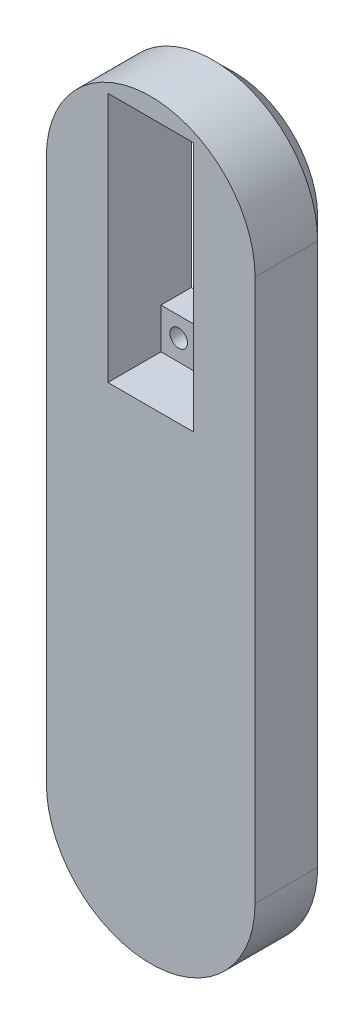
from build123d import *

# Parameters (mm, degrees)
BOSS_EXTRUDE1_DEPTH = 10
CHAMFER1_SIZE       = 5
CUT_EXTRUDE1_DEPTH  = 10.25
SKETCH5_W           = 6.4
SKETCH5_H           = 6.71
CUT_EXTRUDE2_DEPTH  = 24


with BuildPart() as part:
    # Sketch1 → Boss-Extrude1 (new, symmetric)
    with BuildSketch(Plane.XY):
        with BuildLine():
            Line((25, 130), (25, 0))
            ThreePointArc((25, 0), (0, -25), (-25, 0))
            Line((-25, 0), (-25, 130))
            ThreePointArc((-25, 130), (0, 155), (25, 130))
        make_face()
    extrude(amount=BOSS_EXTRUDE1_DEPTH, both=True)

    # Chamfer1
    chamfer1_edges = [part.edges().sort_by_distance(p)[0] for p in [
        (25, 65, -10),
        (0, -25, -10),
        (-25, 65, -10),
        (0, 155, -10),
    ]]
    chamfer(chamfer1_edges, length=CHAMFER1_SIZE)

    # Sketch3 → Cut-Extrude1 (cut, symmetric)
    with BuildSketch(Plane(origin=(0, 0, 0), x_dir=(0, 0, -1), z_dir=(1, 0, 0))):
        Polygon((2.7, 140.79), (2.7, 150.5), (-10, 150.5), (-10, 120.5), (10, 120.5), (10, 140.79), align=None)
    cut_extrude1 = extrude(amount=CUT_EXTRUDE1_DEPTH, both=True, mode=Mode.SUBTRACT)

    # Sketch4 → Cut-Revolve1 (revolve, cut)
    with BuildSketch(Plane(origin=(-6, 0, 0), x_dir=(0, 0, -1), z_dir=(1, 0, 0)), mode=Mode.PRIVATE) as cut_revolve1_sk:
        Polygon((2.7, 145.5), (12.7, 145.5), (12.7, 146.85), (8.7, 146.85), (8.7, 147.6), (2.7, 147.6), align=None)
    cut_revolve1 = revolve(cut_revolve1_sk.sketch.rotate(Axis((-6, 145.5, -58.145818423), (0, 0, 1)), 90), axis=Axis((-6, 145.5, -58.145818423), (0, 0, 1)), mode=Mode.SUBTRACT)

    # Mirror1: Cut-Revolve1 across plane
    add(cut_revolve1.mirror(Plane(origin=(0, 0, 0), x_dir=(0, 0, 1), z_dir=(1, 0, 0))), mode=Mode.SUBTRACT)

    # Mirror2: Cut-Extrude1, Cut-Revolve1 across plane
    add(cut_extrude1.mirror(Plane(origin=(-10.25, 120.5, -10), x_dir=(0, 0, 1), z_dir=(0, -1, 0))), mode=Mode.SUBTRACT)
    add(cut_revolve1.mirror(Plane(origin=(-10.25, 120.5, -10), x_dir=(0, 0, 1), z_dir=(0, -1, 0))), mode=Mode.SUBTRACT)

    # Mirror2 copy 1 sketch → Mirror2 copy 1 (revolve, cut)
    with BuildSketch(Plane(origin=(6, 241, 0), x_dir=(0, 0, -1), z_dir=(-1, 0, 0))):
        Polygon((2.7, 145.5), (12.7, 145.5), (12.7, 146.85), (8.7, 146.85), (8.7, 147.6), (2.7, 147.6), align=None)
    revolve(axis=Axis((6, 95.5, -58.145818423), (0, 0, 1)), mode=Mode.SUBTRACT)

    # Sketch5 → Cut-Extrude2 (cut)
    with BuildSketch(Plane.XY.offset(-2.7)):
        with Locations((0, 144.145)):
            Rectangle(SKETCH5_W, SKETCH5_H)
    extrude(amount=-CUT_EXTRUDE2_DEPTH, mode=Mode.SUBTRACT)


solid = part.part
